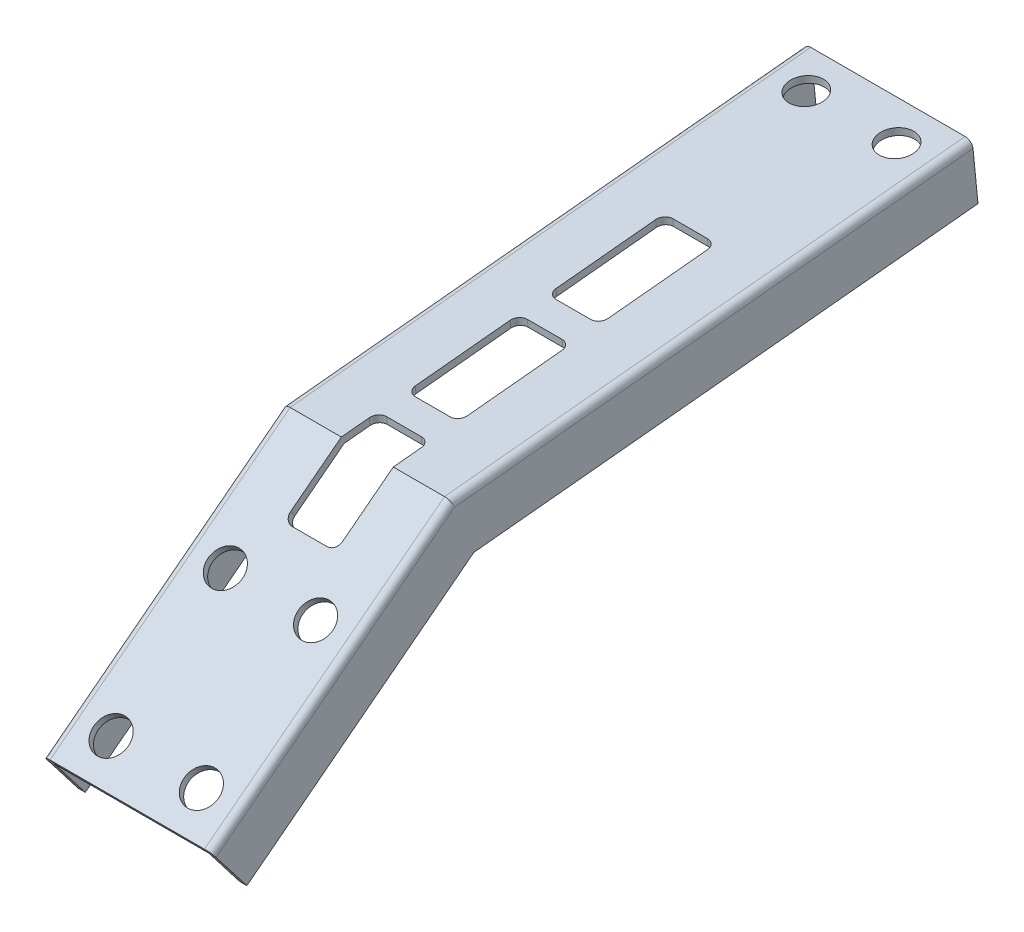
from build123d import *

# Parameters (mm, degrees)
BOSS_EXTRUDE1_DEPTH  = 26.75
BOSS_EXTRUDE2_DEPTH  = 1.25
FILLET1_R            = 1.25
FILLET1_OF_MIRROR1_R = 1.25
SKETCH5_R            = 3
CUT_EXTRUDE1_DEPTH   = 1.25
SKETCH6_R            = 3
CUT_EXTRUDE2_DEPTH   = 1.25
CUT_EXTRUDE3_DEPTH   = 1.25
CUT_EXTRUDE4_DEPTH   = 1.25


with BuildPart() as part:
    # Sketch1 → Boss-Extrude1 (new body)
    with BuildSketch(Plane(origin=(0, 0, 0), x_dir=(0, 0, -1), z_dir=(1, 0, 0))):
        Polygon((45.443853174, 24.716321972), (-44.407308019, 15.814225038), (-85.72558755, -16.072016683), (-86.489274142, -15.082429501), (-44.887235053, 17.022795826), (45.320611525, 25.960231734), align=None)
    extrude(amount=BOSS_EXTRUDE1_DEPTH)

    # Sketch2 → Boss-Extrude2 (add)
    with BuildSketch(Plane(origin=(26.75, 0, 0), x_dir=(0, 0, -1), z_dir=(1, 0, 0))):
        Polygon((46.306544717, 16.008953638), (-41.047818784, 7.354229524), (-80.379781408, -22.999126953), (-86.489274142, -15.082429501), (-44.887235053, 17.022795826), (45.320611525, 25.960231734), align=None)
    boss_extrude2 = extrude(amount=BOSS_EXTRUDE2_DEPTH)

    # Fillet1
    fillet1_edges = [part.edges().sort_by_distance(p)[0] for p in [
        (28, 21.49151378, -0.216688236),
        (28, 0.970183162, 65.688254597),
    ]]
    fillet(fillet1_edges, radius=FILLET1_R)

    # Mirror1: Boss-Extrude2 across plane
    add(boss_extrude2.mirror(Plane(origin=(13.375, 0, 0), x_dir=(0, 0, 1), z_dir=(1, 0, 0))))

    # Fillet1 of Mirror1
    fillet1_of_mirror1_edges = [part.edges().sort_by_distance(p)[0] for p in [
        (-1.25, 21.49151378, -0.216688236),
        (-1.25, 0.970183162, 65.688254597),
    ]]
    fillet(fillet1_of_mirror1_edges, radius=FILLET1_OF_MIRROR1_R)

    # Sketch5 → Cut-Extrude1 (cut)
    with BuildSketch(Plane(origin=(0, 21.261342533, 2.106489551), x_dir=(1, 0, 0), z_dir=(0, 0.9951278095775022, 0.09859331927408967))):
        with Locations(Location((5.55625, 41.309306291, 0), (0, 0, 270))):
            Circle(SKETCH5_R)
        with Locations(Location((21.19375, 41.309306291, 0), (0, 0, 270))):
            Circle(SKETCH5_R)
    extrude(amount=-CUT_EXTRUDE1_DEPTH, mode=Mode.SUBTRACT)

    # Sketch6 → Cut-Extrude2 (cut)
    with BuildSketch(Plane(origin=(0, 32.379495301, 24.987981728), x_dir=(1, 0, 0), z_dir=(0, 0.7916697451364806, 0.6109492733734446))):
        with Locations(Location((21.19375, -71.335540962, 0), (0, 0, 270))):
            Circle(SKETCH6_R)
        with Locations(Location((5.55625, -71.335540962, 0), (0, 0, 270))):
            Circle(SKETCH6_R)
        with Locations(Location((5.55625, -46.335540962, 0), (0, 0, 270))):
            Circle(SKETCH6_R)
        with Locations(Location((21.19375, -46.335540962, 0), (0, 0, 270))):
            Circle(SKETCH6_R)
    extrude(amount=-CUT_EXTRUDE2_DEPTH, mode=Mode.SUBTRACT)

    # Sketch7 → Cut-Extrude3 (cut)
    with BuildSketch(Plane(origin=(0, 21.261342533, 2.106489551), x_dir=(1, 0, 0), z_dir=(0, 0.9951278095775022, 0.09859331927408967))):
        with BuildLine():
            Line((8.875, -42.943848047), (17.875, -42.943848047))
            Line((17.875, -42.943848047), (17.875, -38.104983203))
            ThreePointArc((17.875, -38.104983203), (17.435660172, -37.044323031), (16.375, -36.604983203))
            Line((16.375, -36.604983203), (10.375, -36.604983203))
            ThreePointArc((10.375, -36.604983203), (9.314339828, -37.044323031), (8.875, -38.104983203))
            Line((8.875, -38.104983203), (8.875, -42.943848047))
        make_face()
        with BuildLine():
            Line((17.875, -23.604983203), (17.875, -15.104983203))
            Line((17.875, -15.104983203), (17.875, -13.604983203))
            ThreePointArc((17.875, -13.604983203), (17.435660172, -12.544323031), (16.375, -12.104983203))
            Line((16.375, -12.104983203), (10.375, -12.104983203))
            ThreePointArc((10.375, -12.104983203), (9.314339828, -12.544323031), (8.875, -13.604983203))
            Line((8.875, -13.604983203), (8.875, -15.104983203))
            Line((8.875, -15.104983203), (8.875, -23.604983203))
            Line((8.875, -23.604983203), (8.875, -28.604983203))
            Line((8.875, -28.604983203), (8.875, -30.104983203))
            ThreePointArc((8.875, -30.104983203), (9.314339828, -31.165643374), (10.375, -31.604983203))
            Line((10.375, -31.604983203), (16.375, -31.604983203))
            ThreePointArc((16.375, -31.604983203), (17.435660172, -31.165643374), (17.875, -30.104983203))
            Line((17.875, -30.104983203), (17.875, -28.604983203))
            Line((17.875, -28.604983203), (17.875, -23.604983203))
        make_face()
        with BuildLine():
            Line((16.375, 13.235019835), (10.375, 13.235019835))
            ThreePointArc((10.375, 13.235019835), (9.314339828, 12.795680007), (8.875, 11.735019835))
            Line((8.875, 11.735019835), (8.875, -5.604983203))
            ThreePointArc((8.875, -5.604983203), (9.314339828, -6.665643374), (10.375, -7.104983203))
            Line((10.375, -7.104983203), (16.375, -7.104983203))
            ThreePointArc((16.375, -7.104983203), (17.435660172, -6.665643374), (17.875, -5.604983203))
            Line((17.875, -5.604983203), (17.875, 11.735019835))
            ThreePointArc((17.875, 11.735019835), (17.435660172, 12.795680007), (16.375, 13.235019835))
        make_face()
    extrude(amount=-CUT_EXTRUDE3_DEPTH, mode=Mode.SUBTRACT)

    # Sketch8 → Cut-Extrude4 (cut)
    with BuildSketch(Plane(origin=(0, 32.379495301, 24.987981728), x_dir=(1, 0, 0), z_dir=(0, 0.7916697451364806, 0.6109492733734446))):
        with BuildLine():
            Line((8.875, -25.096490852), (8.875, -36.245103825))
            ThreePointArc((8.875, -36.245103825), (9.314339828, -37.305763997), (10.375, -37.745103825))
            Line((10.375, -37.745103825), (16.375, -37.745103825))
            ThreePointArc((16.375, -37.745103825), (17.435660172, -37.305763997), (17.875, -36.245103825))
            Line((17.875, -36.245103825), (17.875, -25.096490852))
            Line((17.875, -25.096490852), (8.875, -25.096490852))
        make_face()
    extrude(amount=-CUT_EXTRUDE4_DEPTH, mode=Mode.SUBTRACT)


solid = part.part
